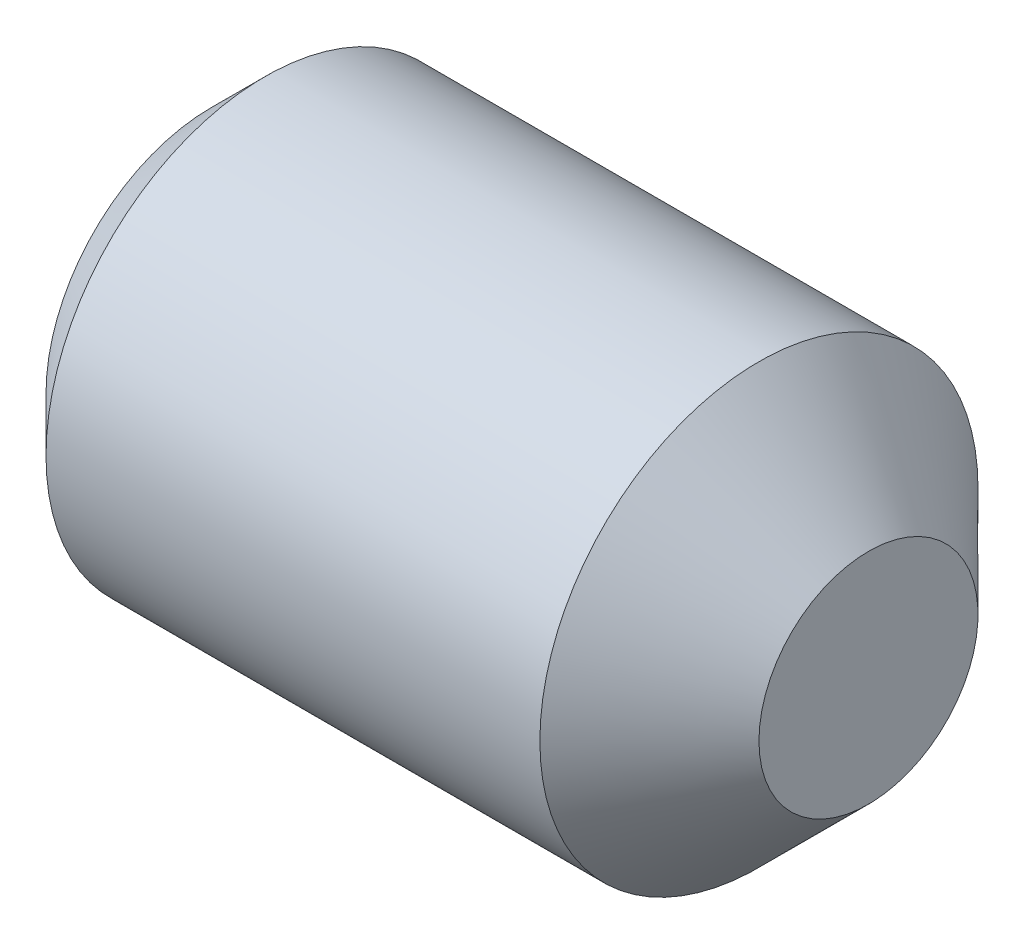
from build123d import *

# Parameters (mm, degrees)
CUT_EXTRUDE1_DEPTH = 0.8


with BuildPart() as part:
    # Sketch1 → Revolve1 (revolve)
    with BuildSketch(Plane.XY, mode=Mode.PRIVATE) as revolve1_sk:
        Polygon((-3, 0), (-3, 0.7545), (-2.7545, 1), (-0.5, 1), (0, 0.5), (0, 0), align=None)
    revolve(revolve1_sk.sketch.rotate(Axis((0, 0, 0), (-1, 0, 0)), 270), axis=Axis((0, 0, 0), (-1, 0, 0)))

    # Sketch2 → Cut-Extrude1 (cut)
    with BuildSketch(Plane.ZY.offset(3)):
        Polygon((-0.259807621, -0.45), (0.259807621, -0.45), (0.519615242, 0), (0.259807621, 0.45), (-0.259807621, 0.45), (-0.519615242, 0), align=None)
    extrude(amount=-CUT_EXTRUDE1_DEPTH, mode=Mode.SUBTRACT)

    # Sketch3 → Cut-Revolve1 (revolve, cut)
    with BuildSketch(Plane.XY, mode=Mode.PRIVATE) as cut_revolve1_sk:
        Polygon((-2.2, 0), (-2.2, 0.45), (-1.940192379, 0), align=None)
    revolve(cut_revolve1_sk.sketch.rotate(Axis((-1.940192379, 0, 0), (-1, 0, 0)), 270), axis=Axis((-1.940192379, 0, 0), (-1, 0, 0)), mode=Mode.SUBTRACT)


solid = part.part
